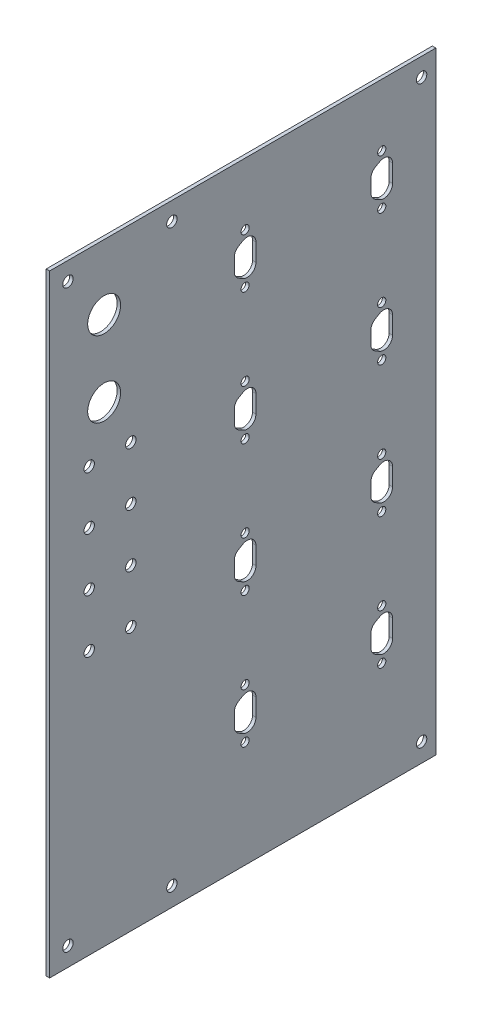
from build123d import *

# Parameters (mm, degrees)
ESBO_O1_W                = 113.35
ESBO_O1_H                = 178.55
ESBO_O1_R                = 1.49999954
ESBO_O1_R_2              = 1.18
ESBO_O1_R_3              = 4.75
ESBO_O1_R_4              = 1.5
RESSALTO_EXTRUS_O2_DEPTH = 1
ESBO_O2_W                = 113.35
ESBO_O2_H                = 178.55
ESBO_O2_W_2              = 111.35
ESBO_O2_H_2              = 176.55
CORTE_EXTRUS_O1_DEPTH    = 586.381527556


with BuildPart() as part:
    # Esboço1 → Ressalto-extrusão2 (new body)
    with BuildSketch(Plane(origin=(0, 0, 0), x_dir=(0, 0, -1), z_dir=(1, 0, 0))):
        with Locations((-487.399286861, -126.719683222)):
            Rectangle(ESBO_O1_W, ESBO_O1_H)
        with Locations((-507.824286861, -209.584683222)):
            Circle(ESBO_O1_R, mode=Mode.SUBTRACT)
        with Locations((-537.796286861, -209.584683222)):
            Circle(ESBO_O1_R, mode=Mode.SUBTRACT)
        with Locations((-537.796286861, -43.722683222)):
            Circle(ESBO_O1_R, mode=Mode.SUBTRACT)
        with Locations((-507.824286861, -43.722683222)):
            Circle(ESBO_O1_R, mode=Mode.SUBTRACT)
        with Locations((-486.710286861, -56.312683222)):
            Circle(ESBO_O1_R_2, mode=Mode.SUBTRACT)
        with Locations((-486.710286861, -70.662683222)):
            Circle(ESBO_O1_R_2, mode=Mode.SUBTRACT)
        with Locations((-447.319286861, -70.662683222)):
            Circle(ESBO_O1_R_2, mode=Mode.SUBTRACT)
        with Locations((-447.319286861, -56.312683222)):
            Circle(ESBO_O1_R_2, mode=Mode.SUBTRACT)
        with Locations((-447.319286861, -94.184349889)):
            Circle(ESBO_O1_R_2, mode=Mode.SUBTRACT)
        with Locations((-447.319286861, -132.056016555)):
            Circle(ESBO_O1_R_2, mode=Mode.SUBTRACT)
        with Locations((-447.319286861, -108.534349889)):
            Circle(ESBO_O1_R_2, mode=Mode.SUBTRACT)
        with Locations((-447.319286861, -146.406016555)):
            Circle(ESBO_O1_R_2, mode=Mode.SUBTRACT)
        with Locations((-447.319286861, -184.277683222)):
            Circle(ESBO_O1_R_2, mode=Mode.SUBTRACT)
        with Locations((-447.319286861, -169.927683222)):
            Circle(ESBO_O1_R_2, mode=Mode.SUBTRACT)
        with Locations((-486.710286861, -184.277683222)):
            Circle(ESBO_O1_R_2, mode=Mode.SUBTRACT)
        with Locations((-486.710286861, -169.927683222)):
            Circle(ESBO_O1_R_2, mode=Mode.SUBTRACT)
        with Locations((-486.710286861, -146.406016555)):
            Circle(ESBO_O1_R_2, mode=Mode.SUBTRACT)
        with Locations((-486.710286861, -132.056016555)):
            Circle(ESBO_O1_R_2, mode=Mode.SUBTRACT)
        with Locations((-486.710286861, -94.184349889)):
            Circle(ESBO_O1_R_2, mode=Mode.SUBTRACT)
        with Locations((-486.710286861, -108.534349889)):
            Circle(ESBO_O1_R_2, mode=Mode.SUBTRACT)
        with Locations((-527.356886861, -79.028683222)):
            Circle(ESBO_O1_R_3, mode=Mode.SUBTRACT)
        with Locations((-527.356886861, -57.210083222)):
            Circle(ESBO_O1_R_3, mode=Mode.SUBTRACT)
        with Locations((-531.668289241, -139.043883661)):
            Circle(ESBO_O1_R_4, mode=Mode.SUBTRACT)
        with Locations((-531.668289241, -123.676879267)):
            Circle(ESBO_O1_R_4, mode=Mode.SUBTRACT)
        with Locations((-531.668289241, -108.309882502)):
            Circle(ESBO_O1_R_4, mode=Mode.SUBTRACT)
        with Locations((-531.668289241, -92.942885737)):
            Circle(ESBO_O1_R_4, mode=Mode.SUBTRACT)
        with Locations((-519.668289241, -92.942885737)):
            Circle(ESBO_O1_R_4, mode=Mode.SUBTRACT)
        with Locations((-519.668289241, -108.309882502)):
            Circle(ESBO_O1_R_4, mode=Mode.SUBTRACT)
        with Locations((-519.668289241, -123.676879267)):
            Circle(ESBO_O1_R_4, mode=Mode.SUBTRACT)
        with Locations((-519.668289241, -139.043883661)):
            Circle(ESBO_O1_R_4, mode=Mode.SUBTRACT)
        with Locations((-435.824286861, -209.584683222)):
            Circle(ESBO_O1_R_4, mode=Mode.SUBTRACT)
        with Locations((-435.824286861, -43.722683222)):
            Circle(ESBO_O1_R_4, mode=Mode.SUBTRACT)
        with BuildLine():
            Line((-489.835286861, -178.932542391), (-489.835286861, -175.272824053))
            ThreePointArc((-489.835286861, -175.272824053), (-489.499010625, -174.017824053), (-488.580286861, -173.09910029))
            Line((-488.580286861, -173.09910029), (-487.350286861, -172.388959458))
            ThreePointArc((-487.350286861, -172.388959458), (-484.840286861, -172.388959458), (-483.585286861, -174.562683222))
            Line((-483.585286861, -174.562683222), (-483.585286861, -179.642683222))
            ThreePointArc((-483.585286861, -179.642683222), (-484.840286861, -181.816406985), (-487.350286861, -181.816406985))
            Line((-487.350286861, -181.816406985), (-488.580286861, -181.106266154))
            ThreePointArc((-488.580286861, -181.106266154), (-489.499010625, -180.187542391), (-489.835286861, -178.932542391))
        make_face(mode=Mode.SUBTRACT)
        with BuildLine():
            Line((-487.350286861, -143.944740319), (-488.580286861, -143.234599488))
            ThreePointArc((-488.580286861, -143.234599488), (-489.499010625, -142.315875724), (-489.835286861, -141.060875724))
            Line((-489.835286861, -141.060875724), (-489.835286861, -137.401157386))
            ThreePointArc((-489.835286861, -137.401157386), (-489.499010625, -136.146157386), (-488.580286861, -135.227433623))
            Line((-488.580286861, -135.227433623), (-487.350286861, -134.517292792))
            ThreePointArc((-487.350286861, -134.517292792), (-484.840286861, -134.517292792), (-483.585286861, -136.691016555))
            Line((-483.585286861, -136.691016555), (-483.585286861, -141.771016555))
            ThreePointArc((-483.585286861, -141.771016555), (-484.840286861, -143.944740319), (-487.350286861, -143.944740319))
        make_face(mode=Mode.SUBTRACT)
        with BuildLine():
            Line((-488.580286861, -105.362932821), (-487.350286861, -106.073073652))
            ThreePointArc((-487.350286861, -106.073073652), (-484.840286861, -106.073073652), (-483.585286861, -103.899349889))
            Line((-483.585286861, -103.899349889), (-483.585286861, -98.819349889))
            ThreePointArc((-483.585286861, -98.819349889), (-484.840286861, -96.645626125), (-487.350286861, -96.645626125))
            Line((-487.350286861, -96.645626125), (-488.580286861, -97.355766956))
            ThreePointArc((-488.580286861, -97.355766956), (-489.499010625, -98.27449072), (-489.835286861, -99.52949072))
            Line((-489.835286861, -99.52949072), (-489.835286861, -103.189209058))
            ThreePointArc((-489.835286861, -103.189209058), (-489.499010625, -104.444209058), (-488.580286861, -105.362932821))
        make_face(mode=Mode.SUBTRACT)
        with BuildLine():
            Line((-489.835286861, -65.317542391), (-489.835286861, -61.657824053))
            ThreePointArc((-489.835286861, -61.657824053), (-489.499010625, -60.402824053), (-488.580286861, -59.48410029))
            Line((-488.580286861, -59.48410029), (-487.350286861, -58.773959458))
            ThreePointArc((-487.350286861, -58.773959458), (-484.840286861, -58.773959458), (-483.585286861, -60.947683222))
            Line((-483.585286861, -60.947683222), (-483.585286861, -66.027683222))
            ThreePointArc((-483.585286861, -66.027683222), (-484.840286861, -68.201406985), (-487.350286861, -68.201406985))
            Line((-487.350286861, -68.201406985), (-488.580286861, -67.491266154))
            ThreePointArc((-488.580286861, -67.491266154), (-489.499010625, -66.572542391), (-489.835286861, -65.317542391))
        make_face(mode=Mode.SUBTRACT)
        with BuildLine():
            Line((-447.959286861, -68.201406985), (-449.189286861, -67.491266154))
            ThreePointArc((-449.189286861, -67.491266154), (-450.108010625, -66.572542391), (-450.444286861, -65.317542391))
            Line((-450.444286861, -65.317542391), (-450.444286861, -61.657824053))
            ThreePointArc((-450.444286861, -61.657824053), (-450.108010625, -60.402824053), (-449.189286861, -59.48410029))
            Line((-449.189286861, -59.48410029), (-447.959286861, -58.773959458))
            ThreePointArc((-447.959286861, -58.773959458), (-445.449286861, -58.773959458), (-444.194286861, -60.947683222))
            Line((-444.194286861, -60.947683222), (-444.194286861, -66.027683222))
            ThreePointArc((-444.194286861, -66.027683222), (-445.449286861, -68.201406985), (-447.959286861, -68.201406985))
        make_face(mode=Mode.SUBTRACT)
        with BuildLine():
            Line((-450.444286861, -103.189209058), (-450.444286861, -99.52949072))
            ThreePointArc((-450.444286861, -99.52949072), (-450.108010625, -98.27449072), (-449.189286861, -97.355766956))
            Line((-449.189286861, -97.355766956), (-447.959286861, -96.645626125))
            ThreePointArc((-447.959286861, -96.645626125), (-445.449286861, -96.645626125), (-444.194286861, -98.819349889))
            Line((-444.194286861, -98.819349889), (-444.194286861, -103.899349889))
            ThreePointArc((-444.194286861, -103.899349889), (-445.449286861, -106.073073652), (-447.959286861, -106.073073652))
            Line((-447.959286861, -106.073073652), (-449.189286861, -105.362932821))
            ThreePointArc((-449.189286861, -105.362932821), (-450.108010625, -104.444209058), (-450.444286861, -103.189209058))
        make_face(mode=Mode.SUBTRACT)
        with BuildLine():
            Line((-449.189286861, -143.234599488), (-447.959286861, -143.944740319))
            ThreePointArc((-447.959286861, -143.944740319), (-445.449286861, -143.944740319), (-444.194286861, -141.771016555))
            Line((-444.194286861, -141.771016555), (-444.194286861, -136.691016555))
            ThreePointArc((-444.194286861, -136.691016555), (-445.449286861, -134.517292792), (-447.959286861, -134.517292792))
            Line((-447.959286861, -134.517292792), (-449.189286861, -135.227433623))
            ThreePointArc((-449.189286861, -135.227433623), (-450.108010625, -136.146157386), (-450.444286861, -137.401157386))
            Line((-450.444286861, -137.401157386), (-450.444286861, -141.060875724))
            ThreePointArc((-450.444286861, -141.060875724), (-450.108010625, -142.315875724), (-449.189286861, -143.234599488))
        make_face(mode=Mode.SUBTRACT)
        with BuildLine():
            Line((-450.444286861, -178.932542391), (-450.444286861, -175.272824053))
            ThreePointArc((-450.444286861, -175.272824053), (-450.108010625, -174.017824053), (-449.189286861, -173.09910029))
            Line((-449.189286861, -173.09910029), (-447.959286861, -172.388959458))
            ThreePointArc((-447.959286861, -172.388959458), (-445.449286861, -172.388959458), (-444.194286861, -174.562683222))
            Line((-444.194286861, -174.562683222), (-444.194286861, -179.642683222))
            ThreePointArc((-444.194286861, -179.642683222), (-445.449286861, -181.816406985), (-447.959286861, -181.816406985))
            Line((-447.959286861, -181.816406985), (-449.189286861, -181.106266154))
            ThreePointArc((-449.189286861, -181.106266154), (-450.108010625, -180.187542391), (-450.444286861, -178.932542391))
        make_face(mode=Mode.SUBTRACT)
    extrude(amount=RESSALTO_EXTRUS_O2_DEPTH)

    # Esboço2 → Corte-extrusão1 (cut, through all)
    with BuildSketch(Plane(origin=(1, 0, 0), x_dir=(0, 0, -1), z_dir=(1, 0, 0))):
        with Locations((-487.399286861, -126.719683222)):
            Rectangle(ESBO_O2_W, ESBO_O2_H)
        with Locations((-487.399286861, -126.719683222)):
            Rectangle(ESBO_O2_W_2, ESBO_O2_H_2, mode=Mode.SUBTRACT)
    extrude(amount=-CORTE_EXTRUS_O1_DEPTH, mode=Mode.SUBTRACT)


solid = part.part
